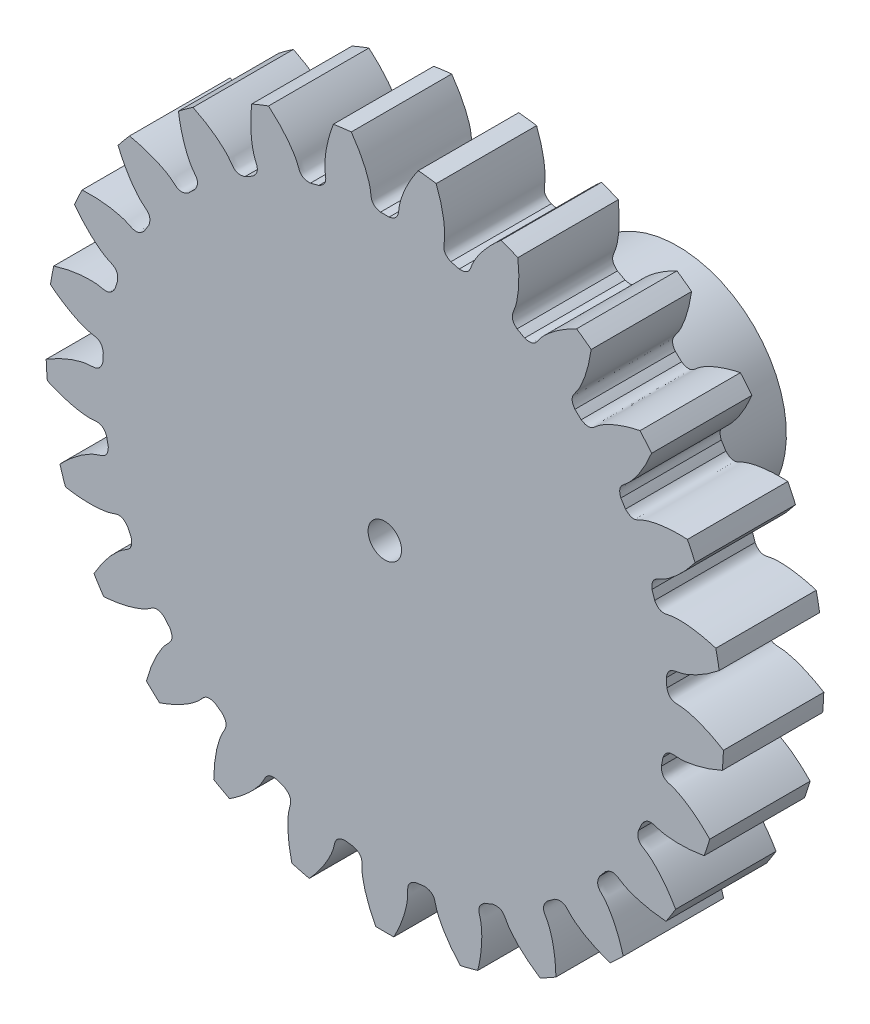
from build123d import *
from build123d.topology import SkipClean

# Parameters (mm, degrees)
SKETCH_1_R               = 20.25
EXTRUDE_1_DEPTH          = 6
CUT_EXTRUDE_1_DEPTH      = 30.259613805
PATTERN_CIRCULAR_1_COUNT = 25
SKETCH_4_R               = 6.5
EXTRUDE_2_DEPTH          = 11.5
EXTRUDE_3_DEPTH          = 7.5
SKETCH_10_OUTSIDE_W      = 54.434
SKETCH_10_OUTSIDE_H      = 54.361
CUT_EXTRUDE_4_DEPTH      = 11.5
CUT_EXTRUDE_2_DEPTH      = 34.55350444
SKETCH_7_R               = 1
CUT_EXTRUDE_3_DEPTH      = 6
SKETCH_8_R               = 6.25
EXTRUDE_4_DEPTH          = 0.5
SKETCH_9_R               = 6.25
SKETCH_9_R_2             = 1
EXTRUDE_5_DEPTH          = 2
EXTRUDE_START            = 8.5
SKETCH_11_R              = 1
EXTRUDE_6_DEPTH          = 8.5
CUT_EXTRUDE_START        = -2.5
SKETCH_12_R              = 6.25
CUT_EXTRUDE_5_DEPTH      = 2.5


with BuildPart() as part:
    # 草图1 → 凸台-拉伸1 (new body)
    with BuildSketch(Plane.XY):
        Circle(SKETCH_1_R)
    extrude(amount=EXTRUDE_1_DEPTH)

    # 草图2 → 切除-拉伸1 (cut, through all)
    with BuildSketch(Plane.XY):
        with BuildLine():
            ThreePointArc((0.258087731, 16.873026276), (0, 16.875), (-0.258087731, 16.873026276))
            add(Edge.make_bspline(
                [(-0.258087731, 16.873026276), (-0.860009719, 17.002621743), (-0.803261453, 17.365892092), (-0.861293078, 17.727079133), (-0.869431907, 17.772162663), (-0.879864646, 17.823983286), (-0.892853278, 17.882466675), (-0.908671177, 17.947527872), (-0.927584894, 18.019074596), (-0.949859769, 18.097006249), (-0.975757867, 18.181214325), (-1.005538339, 18.271582373), (-1.039457033, 18.367986118), (-1.077766339, 18.470293527), (-1.120714966, 18.578364907), (-1.168547739, 18.692053), (-1.221505397, 18.811203081), (-1.279824393, 18.935653067), (-1.343736695, 19.065233623), (-1.413469592, 19.199768283), (-1.489245502, 19.339073564), (-1.571281784, 19.482959099), (-1.659790547, 19.63122776), (-1.754978474, 19.783675797), (-1.857046639, 19.940092974), (-1.966190331, 20.100262717), (-2.082598879, 20.263962258), (-2.206455491, 20.430962791), (-2.337937079, 20.601029625), (-2.477214104, 20.773922351), (-2.624450417, 20.949394998), (-2.779803105, 21.127196214), (-2.943422343, 21.307069427), (-3.115451247, 21.488753029), (-3.296025735, 21.671980558), (-3.485274392, 21.856480874), (-3.683318332, 22.041978354), (-3.890271089, 22.228193081), (-4.106238429, 22.414841038), (-4.409960917, 22.666899411), (-4.646199824, 22.851139729), (-4.807907214, 22.972251257)],
                knots=[0, 0, 0, 0, 0.130741207, 0.13574479, 0.141658115, 0.148481183, 0.156213993, 0.164856545, 0.174408839, 0.184870876, 0.196242655, 0.208524177, 0.221715441, 0.235816447, 0.250827195, 0.266747686, 0.283577919, 0.301317894, 0.319967612, 0.339527072, 0.359996274, 0.381375219, 0.403663906, 0.426862335, 0.450970507, 0.475988421, 0.501916077, 0.528753476, 0.556500617, 0.5851575, 0.614724126, 0.645200493, 0.676586604, 0.708882456, 0.742088051, 0.776203388, 0.811228468, 0.847163289, 0.884007854, 0.92176216, 1, 1, 1, 1], degree=3))
            ThreePointArc((-4.807907214, 22.972251257), (0, 23.469987209), (4.807907214, 22.972251257))
            add(Edge.make_bspline(
                [(0.258087731, 16.873026276), (0.860009719, 17.002621743), (0.803261453, 17.365892092), (0.861293078, 17.727079133), (0.869431907, 17.772162663), (0.879864646, 17.823983286), (0.892853278, 17.882466675), (0.908671177, 17.947527872), (0.927584894, 18.019074596), (0.949859769, 18.097006249), (0.975757867, 18.181214325), (1.005538339, 18.271582373), (1.039457033, 18.367986118), (1.077766339, 18.470293527), (1.120714966, 18.578364907), (1.168547739, 18.692053), (1.221505397, 18.811203081), (1.279824393, 18.935653067), (1.343736695, 19.065233623), (1.413469592, 19.199768283), (1.489245502, 19.339073564), (1.571281784, 19.482959099), (1.659790547, 19.63122776), (1.754978474, 19.783675797), (1.857046639, 19.940092974), (1.966190331, 20.100262717), (2.082598879, 20.263962258), (2.206455491, 20.430962791), (2.337937079, 20.601029625), (2.477214104, 20.773922351), (2.624450417, 20.949394998), (2.779803105, 21.127196214), (2.943422343, 21.307069427), (3.115451247, 21.488753029), (3.296025735, 21.671980558), (3.485274392, 21.856480874), (3.683318332, 22.041978354), (3.890271089, 22.228193081), (4.106238429, 22.414841038), (4.409960917, 22.666899411), (4.646199824, 22.851139729), (4.807907214, 22.972251257)],
                knots=[0, 0, 0, 0, 0.130741207, 0.13574479, 0.141658115, 0.148481183, 0.156213993, 0.164856545, 0.174408839, 0.184870876, 0.196242655, 0.208524177, 0.221715441, 0.235816447, 0.250827195, 0.266747686, 0.283577919, 0.301317894, 0.319967612, 0.339527072, 0.359996274, 0.381375219, 0.403663906, 0.426862335, 0.450970507, 0.475988421, 0.501916077, 0.528753476, 0.556500617, 0.5851575, 0.614724126, 0.645200493, 0.676586604, 0.708882456, 0.742088051, 0.776203388, 0.811228468, 0.847163289, 0.884007854, 0.92176216, 1, 1, 1, 1], degree=3))
        make_face()
    cut_extrude_1 = extrude(amount=CUT_EXTRUDE_1_DEPTH, mode=Mode.SUBTRACT)

    # 阵列(圆周)1: 切除-拉伸1 ×25 about axis
    pattern_circular_1_axis = Axis((0, 0, -0.3), (0, 0, 1))
    for i in range(1, PATTERN_CIRCULAR_1_COUNT):
        add(cut_extrude_1.rotate(pattern_circular_1_axis, i * 360 / PATTERN_CIRCULAR_1_COUNT), mode=Mode.SUBTRACT)

    # 草图4 → 凸台-拉伸2 (add)
    with BuildSketch(Plane(origin=(0, 0, 0), x_dir=(-1, 0, 0), z_dir=(0, 0, -1))):
        Circle(SKETCH_4_R)
        with BuildLine():
            Line((-1.658312395, -2.5), (1.658312395, -2.5))
            ThreePointArc((1.658312395, -2.5), (0, 3), (-1.658312395, -2.5))
        make_face(mode=Mode.SUBTRACT)
    extrude(amount=EXTRUDE_2_DEPTH)

    # 草图5 → 凸台-拉伸3 (add)
    with BuildSketch(Plane(origin=(0, 0, 0), x_dir=(-1, 0, 0), z_dir=(0, 0, -1))):
        with BuildLine():
            Line((-3.75, -5), (3.75, -5))
            ThreePointArc((3.75, -5), (0, 6.25), (-3.75, -5))
        make_face()
    extrude(amount=EXTRUDE_3_DEPTH)

    # 草图10 outside → 切除-拉伸4 (cut)
    with BuildSketch(Plane(origin=(0, 0, -11.5), x_dir=(-1, 0, 0), z_dir=(0, 0, -1))):
        with Locations((0, -0.0495)):
            Rectangle(SKETCH_10_OUTSIDE_W, SKETCH_10_OUTSIDE_H)
        with BuildLine():
            Line((4.153311931, -5), (-4.153311931, -5))
            ThreePointArc((-4.153311931, -5), (0, 6.5), (4.153311931, -5))
        make_face(mode=Mode.SUBTRACT)
    extrude(amount=-CUT_EXTRUDE_4_DEPTH, mode=Mode.SUBTRACT)

    # 草图6 → 切除-拉伸2 (cut, through all)
    with BuildSketch(Plane(origin=(0, 0, -11.5), x_dir=(-1, 0, 0), z_dir=(0, 0, -1))):
        with BuildLine():
            Line((-1.658312395, -2.5), (1.658312395, -2.5))
            ThreePointArc((1.658312395, -2.5), (0, 3), (-1.658312395, -2.5))
        make_face()
    extrude(amount=-CUT_EXTRUDE_2_DEPTH, mode=Mode.SUBTRACT)

    # 草图7 → 切除-拉伸3 (cut)
    with BuildSketch(Plane.XZ.offset(5)):
        with Locations((0, -9)):
            Circle(SKETCH_7_R)
    extrude(amount=-CUT_EXTRUDE_3_DEPTH, mode=Mode.SUBTRACT)

    # 草图8 → 凸台-拉伸4 (add)
    with BuildSketch(Plane.XY.offset(6)):
        Circle(SKETCH_8_R)
        with BuildLine():
            Line((1.658312395, -2.5), (-1.658312395, -2.5))
            ThreePointArc((-1.658312395, -2.5), (0, 3), (1.658312395, -2.5))
        make_face(mode=Mode.SUBTRACT)
    extrude(amount=EXTRUDE_4_DEPTH)

    # 草图9 → 凸台-拉伸5 (add)
    with BuildSketch(Plane.XY.offset(6.5)):
        Circle(SKETCH_9_R)
        Circle(SKETCH_9_R_2, mode=Mode.SUBTRACT)
    extrude(amount=EXTRUDE_5_DEPTH)

    # 草图11 → 凸台-拉伸6 (add)
    with SkipClean():  # the faces are left unmerged after this step: merging them gives an invalid solid
        with BuildSketch(Plane(origin=(0, 0, 6.5), x_dir=(-1, 0, 0), z_dir=(0, 0, -1)).offset(EXTRUDE_START)):
            with BuildLine():
                Line((1.658312395, -2.5), (-1.658312395, -2.5))
                ThreePointArc((-1.658312395, -2.5), (0, 3), (1.658312395, -2.5))
            make_face()
            Circle(SKETCH_11_R, mode=Mode.SUBTRACT)
        extrude(amount=-EXTRUDE_6_DEPTH)

    # 草图12 → 切除-拉伸5 (cut)
    with BuildSketch(Plane.XY.offset(8.5).offset(CUT_EXTRUDE_START)):
        Circle(SKETCH_12_R)
    extrude(amount=CUT_EXTRUDE_5_DEPTH, mode=Mode.SUBTRACT)


solid = part.part
